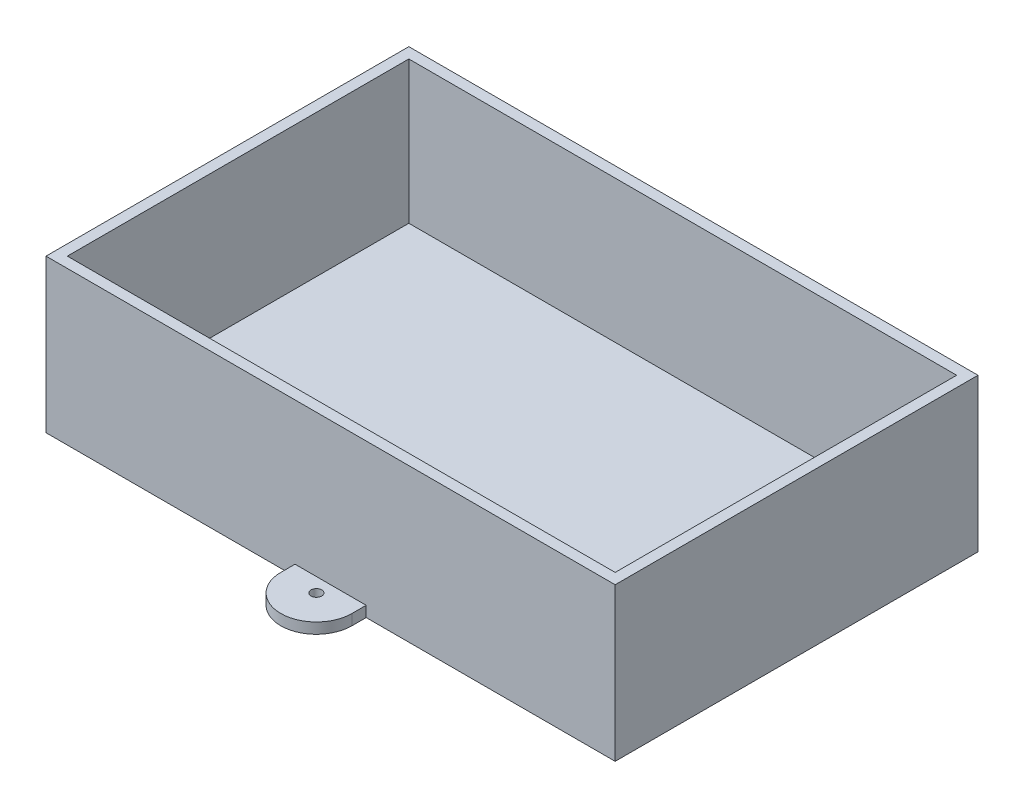
from build123d import *

# Parameters (mm, degrees)
SKETCH1_W           = 160
SKETCH1_H           = 102
SKETCH1_W_2         = 154
SKETCH1_H_2         = 96
BOSS_EXTRUDE1_DEPTH = 40
SKETCH2_W           = 160
SKETCH2_H           = 102
BOSS_EXTRUDE2_DEPTH = 3
SKETCH3_R           = 1.5
BOSS_EXTRUDE3_DEPTH = 3


with BuildPart() as part:
    # Sketch1 → Boss-Extrude1 (new body)
    with BuildSketch(Plane(origin=(0, 0, 0), x_dir=(1, 0, 0), z_dir=(0, 1, 0))):
        with Locations((77, -48)):
            Rectangle(SKETCH1_W, SKETCH1_H)
        with Locations((77, -48)):
            Rectangle(SKETCH1_W_2, SKETCH1_H_2, mode=Mode.SUBTRACT)
    extrude(amount=BOSS_EXTRUDE1_DEPTH)

    # Sketch2 → Boss-Extrude2 (add)
    with BuildSketch(Plane.XZ):
        with Locations((77, 48)):
            Rectangle(SKETCH2_W, SKETCH2_H)
    extrude(amount=BOSS_EXTRUDE2_DEPTH)

    # Sketch3 → Boss-Extrude3 (add)
    with BuildSketch(Plane.XZ.offset(3)):
        with BuildLine():
            Line((87, 103), (87, -7))
            ThreePointArc((87, -7), (77, -17), (67, -7))
            Line((67, -7), (67, 103))
            ThreePointArc((67, 103), (77, 113), (87, 103))
        make_face()
        with Locations(Location((77, -7, 0), (0, 0, 270))):
            Circle(SKETCH3_R, mode=Mode.SUBTRACT)
        with Locations(Location((77, 103, 0), (0, 0, 270))):
            Circle(SKETCH3_R, mode=Mode.SUBTRACT)
    extrude(amount=-BOSS_EXTRUDE3_DEPTH)


solid = part.part
